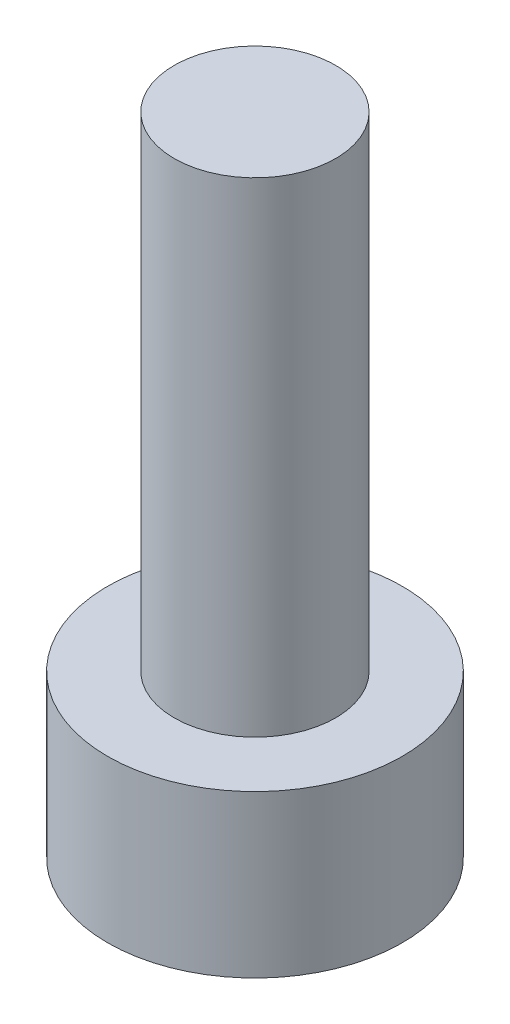
from build123d import *

# Parameters (mm, degrees)
SKETCH_1_R        = 3.65
EXTRUDE_226_DEPTH = 4
SKETCH_2_R        = 2
EXTRUDE_318_DEPTH = 12


with BuildPart() as part:
    # 草图1 → Extrude 226 (new body)
    with BuildSketch(Plane(origin=(0, 0, 0), x_dir=(1, 0, 0), z_dir=(0, 1, 0))):
        with Locations(Location((0, 0, 0), (0, 0, 270))):
            Circle(SKETCH_1_R)
    extrude(amount=EXTRUDE_226_DEPTH)

    # 草图2 → Extrude 318 (add)
    with BuildSketch(Plane(origin=(0, 4, 0), x_dir=(1, 0, 0), z_dir=(0, 1, 0))):
        with Locations(Location((0, 0, 0), (0, 0, 270))):
            Circle(SKETCH_2_R)
    extrude(amount=EXTRUDE_318_DEPTH)


solid = part.part
